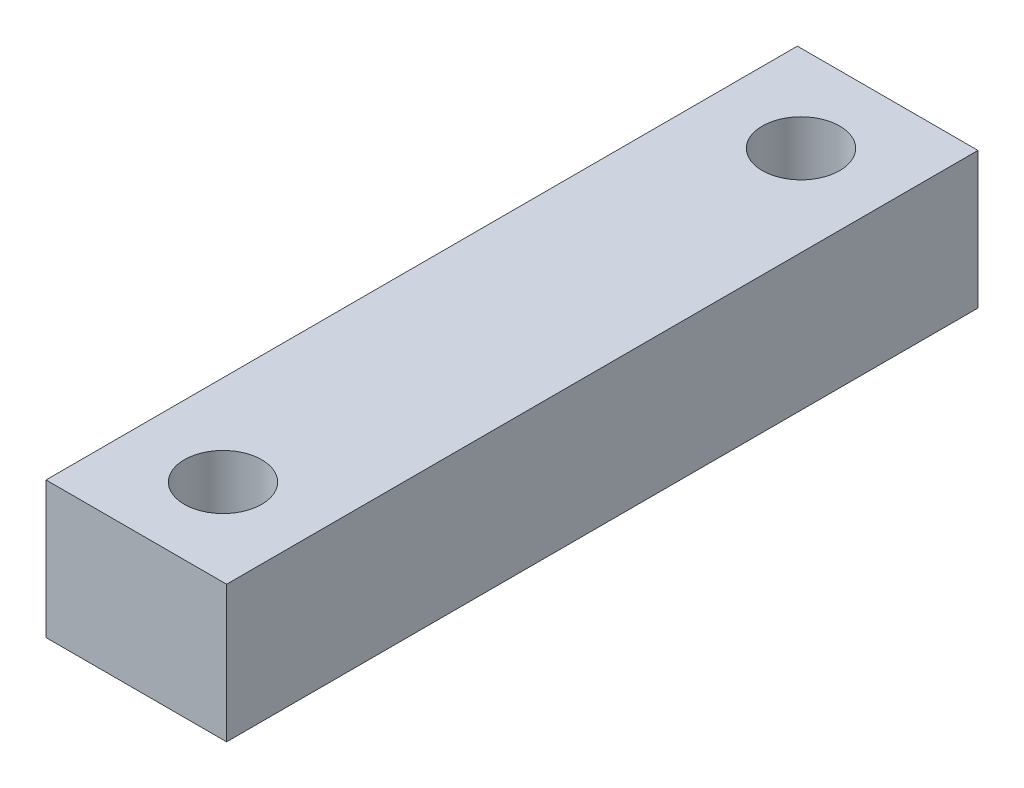
from build123d import *

# Parameters (mm, degrees)
SKETCH1_W           = 19.84375
SKETCH1_H           = 82.55
SKETCH1_R           = 4.25
BOSS_EXTRUDE1_DEPTH = 15


with BuildPart() as part:
    # Sketch1 → Boss-Extrude1 (new body)
    with BuildSketch(Plane(origin=(0, 0, 0), x_dir=(1, 0, 0), z_dir=(0, 1, 0))):
        Rectangle(SKETCH1_W, SKETCH1_H)
        with Locations(Location((0, -31.75, 0), (0, 0, 270))):
            Circle(SKETCH1_R, mode=Mode.SUBTRACT)
        with Locations(Location((0, 31.75, 0), (0, 0, 270))):
            Circle(SKETCH1_R, mode=Mode.SUBTRACT)
    extrude(amount=BOSS_EXTRUDE1_DEPTH)


solid = part.part
